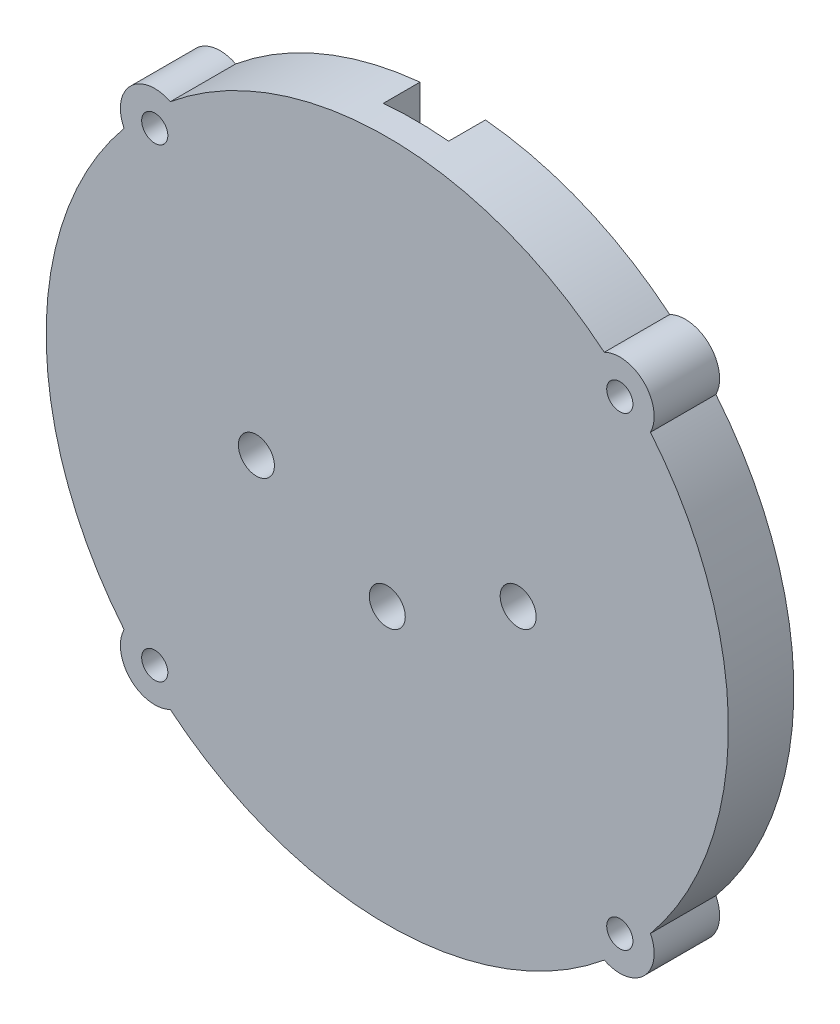
from build123d import *

# Parameters (mm, degrees)
BOSS_EXTRUDE1_DEPTH = 8
CUT_EXTRUDE4_DEPTH  = 1.7
CUT_EXTRUDE5_DEPTH  = 7.4
CUT_EXTRUDE6_DEPTH  = 4.5
SKETCH3_R           = 2.2
CUT_EXTRUDE7_DEPTH  = 6
SKETCH1_10_R        = 1.6
CUT_EXTRUDE8_DEPTH  = 60.512855754


with BuildPart() as part:
    # Sketch1 → Boss-Extrude1 (new body)
    with BuildSketch(Plane.XY):
        with BuildLine():
            ThreePointArc((-32.17302157, 26.528978176), (-41.7, 0), (-32.17302157, -26.528978176))
            ThreePointArc((-32.17302157, -26.528978176), (-31.395541085, -31.395541085), (-26.528978176, -32.17302157))
            ThreePointArc((-26.528978176, -32.17302157), (0, -41.7), (26.528978176, -32.17302157))
            ThreePointArc((26.528978176, -32.17302157), (31.395541085, -31.395541085), (32.17302157, -26.528978176))
            ThreePointArc((32.17302157, -26.528978176), (41.7, 0), (32.17302157, 26.528978176))
            ThreePointArc((32.17302157, 26.528978176), (31.395541085, 31.395541085), (26.528978176, 32.17302157))
            ThreePointArc((26.528978176, 32.17302157), (0, 41.7), (-26.528978176, 32.17302157))
            ThreePointArc((-26.528978176, 32.17302157), (-31.395541085, 31.395541085), (-32.17302157, 26.528978176))
        make_face()
    extrude(amount=BOSS_EXTRUDE1_DEPTH)

    # Sketch1<7> → Cut-Extrude4 (cut)
    with BuildSketch(Plane.XY):
        with BuildLine():
            Line((-4.282842712, 9.374011537), (-9.475230868, 14.566399692))
            ThreePointArc((-9.475230868, 14.566399692), (-14.566399692, 14.566399692), (-14.566399692, 9.475230868))
            Line((-14.566399692, 9.475230868), (-9.374011537, 4.282842712))
            ThreePointArc((-9.374011537, 4.282842712), (-7.6, 0), (-9.374011537, -4.282842712))
            Line((-9.374011537, -4.282842712), (-14.566399692, -9.475230868))
            ThreePointArc((-14.566399692, -9.475230868), (-14.566399692, -14.566399692), (-9.475230868, -14.566399692))
            Line((-9.475230868, -14.566399692), (-4.282842712, -9.374011537))
            ThreePointArc((-4.282842712, -9.374011537), (0, -7.6), (4.282842712, -9.374011537))
            Line((4.282842712, -9.374011537), (9.475230868, -14.566399692))
            ThreePointArc((9.475230868, -14.566399692), (14.566399692, -14.566399692), (14.566399692, -9.475230868))
            Line((14.566399692, -9.475230868), (9.374011537, -4.282842712))
            ThreePointArc((9.374011537, -4.282842712), (7.6, 0), (9.374011537, 4.282842712))
            Line((9.374011537, 4.282842712), (14.566399692, 9.475230868))
            ThreePointArc((14.566399692, 9.475230868), (14.566399692, 14.566399692), (9.475230868, 14.566399692))
            Line((9.475230868, 14.566399692), (4.282842712, 9.374011537))
            ThreePointArc((4.282842712, 9.374011537), (0, 7.6), (-4.282842712, 9.374011537))
        make_face()
    extrude(amount=CUT_EXTRUDE4_DEPTH, mode=Mode.SUBTRACT)

    # Sketch1<8> → Cut-Extrude5 (cut)
    with BuildSketch(Plane.XY):
        Polygon((-7.1, -3.85), (7.1, -3.85), (7.1, 3.85), (7.1, 7.6), (-7.1, 7.6), (-7.1, 3.85), align=None)
    extrude(amount=CUT_EXTRUDE5_DEPTH, mode=Mode.SUBTRACT)

    # Sketch1<9> → Cut-Extrude6 (cut)
    with BuildSketch(Plane.XY):
        with BuildLine():
            Line((-4, 7.6), (4, 7.6))
            Line((4, 7.6), (4, 41.507710127))
            ThreePointArc((4, 41.507710127), (0, 41.7), (-4, 41.507710127))
            Line((-4, 41.507710127), (-4, 7.6))
        make_face()
    extrude(amount=CUT_EXTRUDE6_DEPTH, mode=Mode.SUBTRACT)

    # Sketch3 → Cut-Extrude7 (cut)
    with BuildSketch(Plane.XY.offset(8)):
        with Locations((-16, 0)):
            Circle(SKETCH3_R)
        with Locations((16, 0)):
            Circle(SKETCH3_R)
        with Locations((0, -8)):
            Circle(SKETCH3_R)
    extrude(amount=-CUT_EXTRUDE7_DEPTH, mode=Mode.SUBTRACT)

    # Sketch1<10> → Cut-Extrude8 (cut, through all)
    with BuildSketch(Plane.XY):
        with Locations((-28.425692604, 28.425692604)):
            Circle(SKETCH1_10_R)
        with Locations((28.425692604, 28.425692604)):
            Circle(SKETCH1_10_R)
        with Locations((28.425692604, -28.425692604)):
            Circle(SKETCH1_10_R)
        with Locations((-28.425692604, -28.425692604)):
            Circle(SKETCH1_10_R)
    extrude(amount=CUT_EXTRUDE8_DEPTH, mode=Mode.SUBTRACT)


solid = part.part
